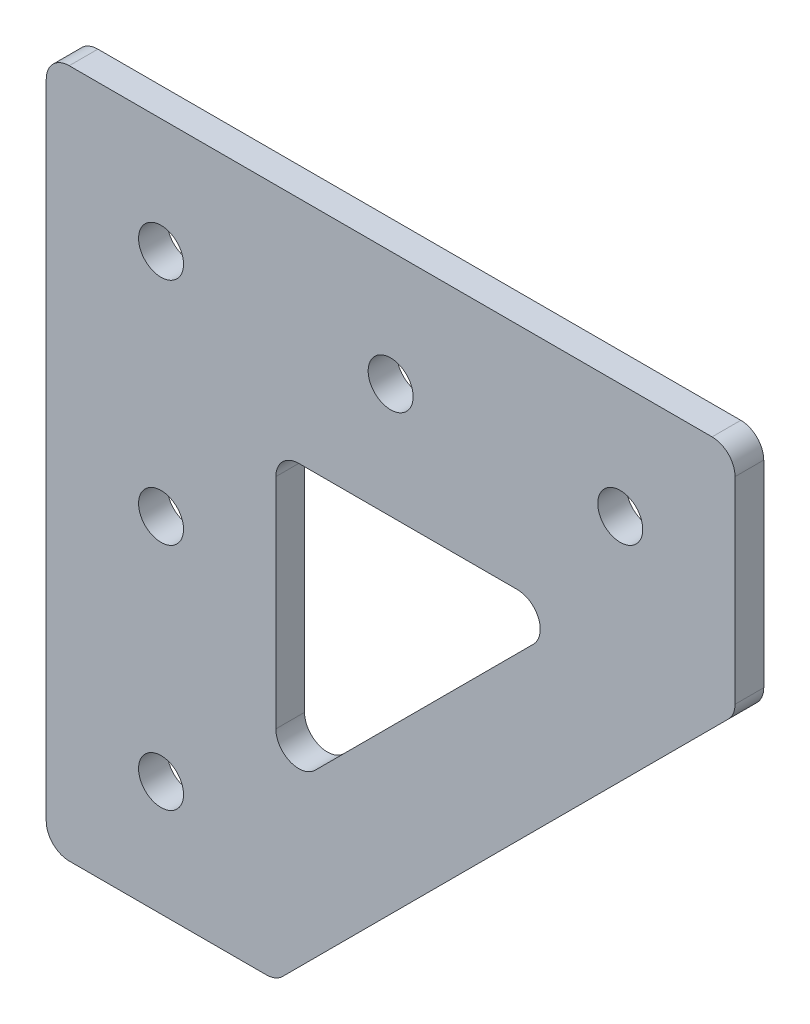
from build123d import *

# Parameters (mm, degrees)
BOSS_EXTRUDE1_DEPTH = 3.175
SKETCH2_R           = 2.4892
CUT_EXTRUDE1_DEPTH  = 108.809835474
FILLET3_R           = 2.54


with BuildPart() as part:
    # Sketch1 → Boss-Extrude1 (new body)
    with BuildSketch(Plane.XY):
        Polygon((25.4, 0), (0, 0), (0, 76.2), (76.2, 76.2), (76.2, 50.8), align=None)
        Polygon((58.239487758, 50.8), (25.4, 50.8), (25.4, 17.960512242), align=None, mode=Mode.SUBTRACT)
    extrude(amount=-BOSS_EXTRUDE1_DEPTH)

    # Sketch2 → Cut-Extrude1 (cut, through all)
    with BuildSketch(Plane.XY):
        with Locations((12.7, 63.5)):
            Circle(SKETCH2_R)
        with Locations((38.1, 63.5)):
            Circle(SKETCH2_R)
        with Locations((63.5, 63.5)):
            Circle(SKETCH2_R)
        with Locations((12.7, 38.1)):
            Circle(SKETCH2_R)
        with Locations((12.7, 12.7)):
            Circle(SKETCH2_R)
    extrude(amount=-CUT_EXTRUDE1_DEPTH, mode=Mode.SUBTRACT)

    # Fillet3
    fillet3_edges = [part.edges().sort_by_distance(p)[0] for p in [
        (25.4, 50.8, -1.5875),
        (25.4, 17.960512242, -1.5875),
        (58.239487758, 50.8, -1.5875),
        (0, 0, -1.5875),
        (0, 76.2, -1.5875),
        (76.2, 76.2, -1.5875),
        (76.2, 50.8, -1.5875),
        (25.4, 0, -1.5875),
    ]]
    fillet(fillet3_edges, radius=FILLET3_R)


solid = part.part
